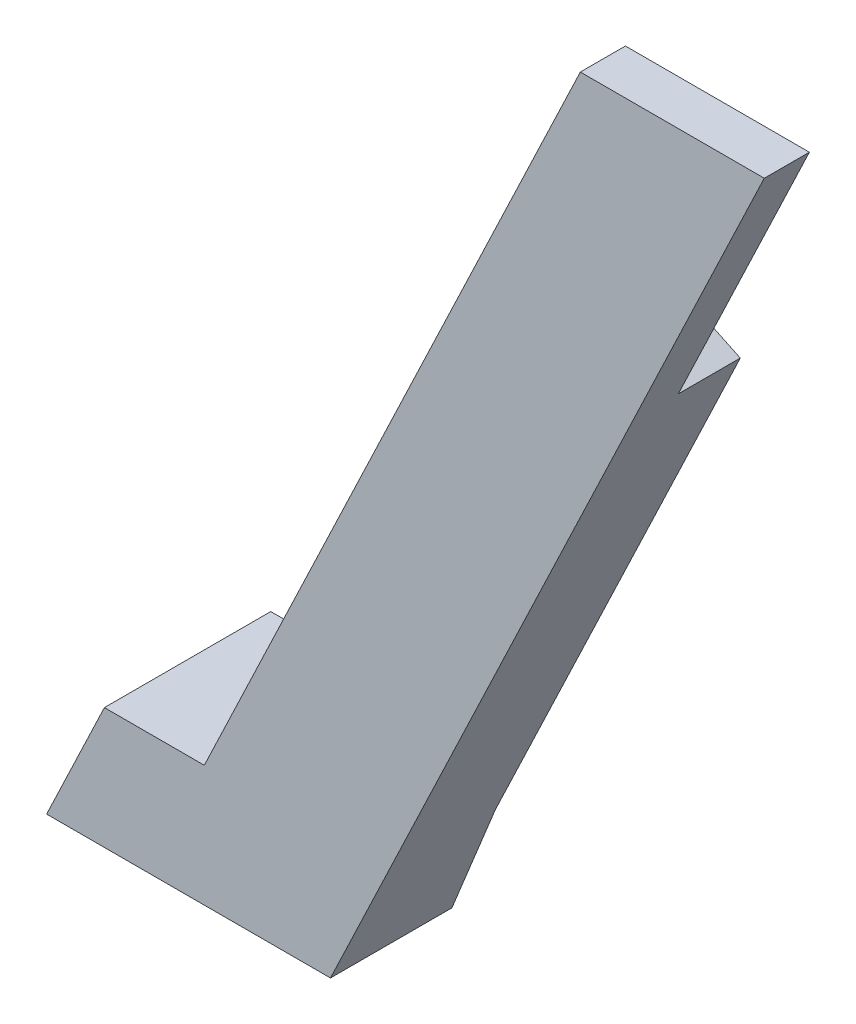
from build123d import *

# Parameters (mm, degrees)
BOSS_EXTRUDE1_DEPTH = 4
BOSS_EXTRUDE2_DEPTH = 5.5
BOSS_EXTRUDE3_DEPTH = 5.26
CUT_EXTRUDE1_DEPTH  = 25.26


with BuildPart() as part:
    # Sketch1 → Boss-Extrude1 (new body)
    with BuildSketch(Plane.XY):
        Polygon((6.798067323, 45.385579117), (-26.566371189, -24.564420883), (-35.429799542, -24.564420883), (-40.556683823, -35.313157307), (-15.371402202, -35.313157307), (23.119920592, 45.385579117), align=None)
    extrude(amount=-BOSS_EXTRUDE1_DEPTH)

    # Sketch2 → Boss-Extrude2 (add)
    with BuildSketch(Plane(origin=(0, 0, -4), x_dir=(-1, 0, 0), z_dir=(0, 0, -1))):
        Polygon((40.556683823, -35.313157307), (35.429799542, -24.564420883), (26.566371189, -24.564420883), (8.815605583, 12.650833126), (-1.251818738, 7.848918048), (-8.260923666, 22.543811707), (-11.490263359, 21.003495686), (15.371402202, -35.313157307), align=None)
        Polygon((5.218881417, 14.259069333), (0.164403825, 11.848207191), (-4.312911582, 21.235094148), (0.74156601, 23.645956291), align=None)
    extrude(amount=BOSS_EXTRUDE2_DEPTH)

    # Sketch3 → Boss-Extrude3 (add)
    with BuildSketch(Plane(origin=(0, 0, -9.5), x_dir=(-1, 0, 0), z_dir=(0, 0, -1))):
        Polygon((40.556683823, -35.313157307), (35.429799542, -24.564420883), (10.244517921, -24.564420883), (15.371402202, -35.313157307), align=None)
    extrude(amount=BOSS_EXTRUDE3_DEPTH)

    # Sketch4 → Cut-Extrude1 (cut)
    with BuildSketch(Plane.XZ.offset(35.313157307)):
        Polygon((-31.448639935, -14.76), (-10.244517921, -9.5), (-10.244517921, -14.76), align=None)
    extrude(amount=-CUT_EXTRUDE1_DEPTH, mode=Mode.SUBTRACT)


solid = part.part
